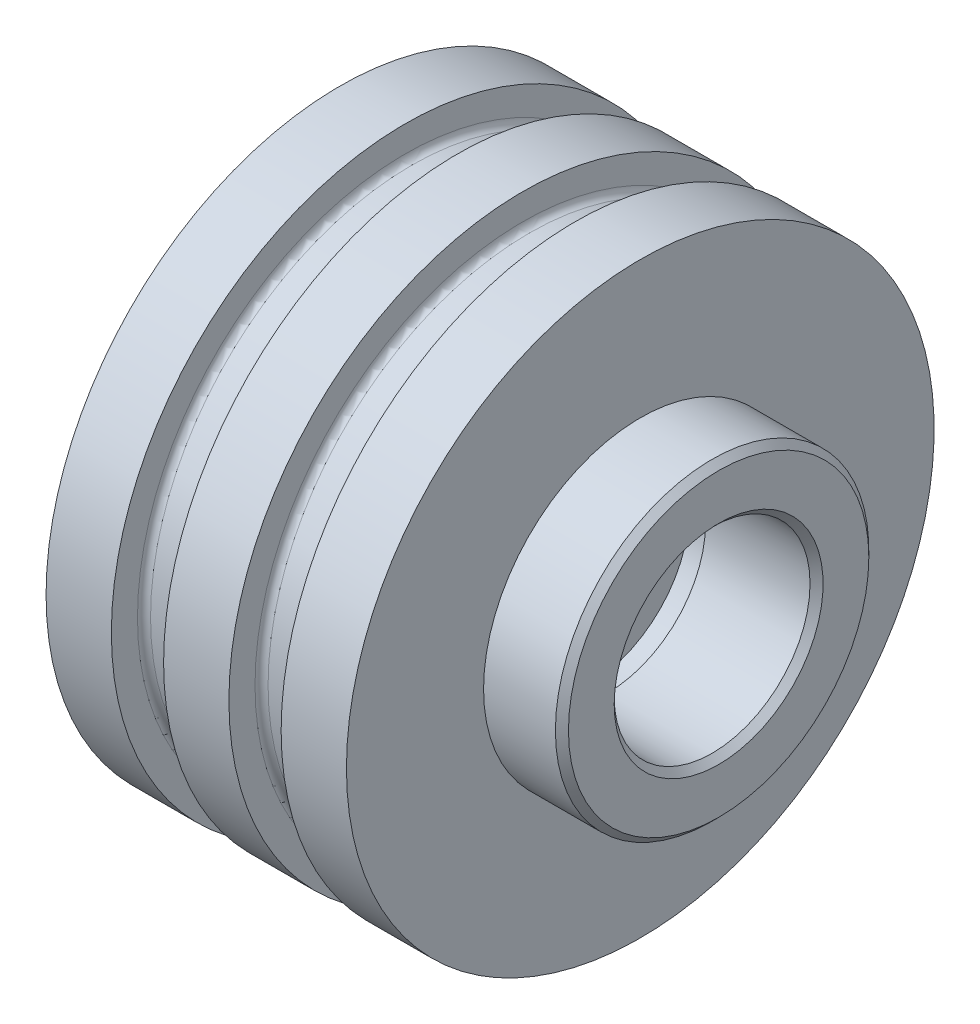
from build123d import *

# Parameters (mm, degrees)
CHAMFER_1_SIZE = 1


with BuildPart() as part:
    # Эскиз1 → Повернуть1 (revolve)
    with BuildSketch(Plane.XY, mode=Mode.PRIVATE) as revolve_1_sk:
        with BuildLine():
            Line((0, 42), (0, 45))
            Line((0, 45), (10, 45))
            Line((10, 45), (10, 41))
            ThreePointArc((10, 41), (10.292893219, 40.292893219), (11, 40))
            Line((11, 40), (17, 40))
            ThreePointArc((17, 40), (17.707106781, 40.292893219), (18, 41))
            Line((18, 41), (18, 45))
            Line((18, 45), (28, 45))
            Line((28, 45), (28, 41))
            ThreePointArc((28, 41), (28.292893219, 40.292893219), (29, 40))
            Line((29, 40), (35, 40))
            ThreePointArc((35, 40), (35.707106781, 40.292893219), (36, 41))
            Line((36, 41), (36, 45))
            Line((36, 45), (46, 45))
            Line((46, 45), (46, 24))
            Line((46, 24), (57, 24))
            Line((57, 24), (58, 23))
            Line((58, 23), (58, 0))
            Line((58, 0), (2, 0))
            Line((2, 0), (2, 42))
            Line((2, 42), (0, 42))
        make_face()
    revolve(revolve_1_sk.sketch.rotate(Axis((2, 0, 0), (1, 0, 0)), 90), axis=Axis((2, 0, 0), (1, 0, 0)))

    # Эскиз2 → Вырез-Повернуть1 (revolve, cut)
    with BuildSketch(Plane.XY, mode=Mode.PRIVATE) as cut_revolve_1_sk:
        Polygon((58, 0), (58, 15), (41, 15), (41, 15.5), (38, 15.5), (38, 0), align=None)
    revolve(cut_revolve_1_sk.sketch.rotate(Axis((0, 0, 0), (1, 0, 0)), 90), axis=Axis((0, 0, 0), (1, 0, 0)), mode=Mode.SUBTRACT)

    # Фаска1
    chamfer_1_edges = [part.edges().sort_by_distance(p)[0] for p in [
        (58, 0, -15),
    ]]
    chamfer(chamfer_1_edges, length=CHAMFER_1_SIZE)


solid = part.part
